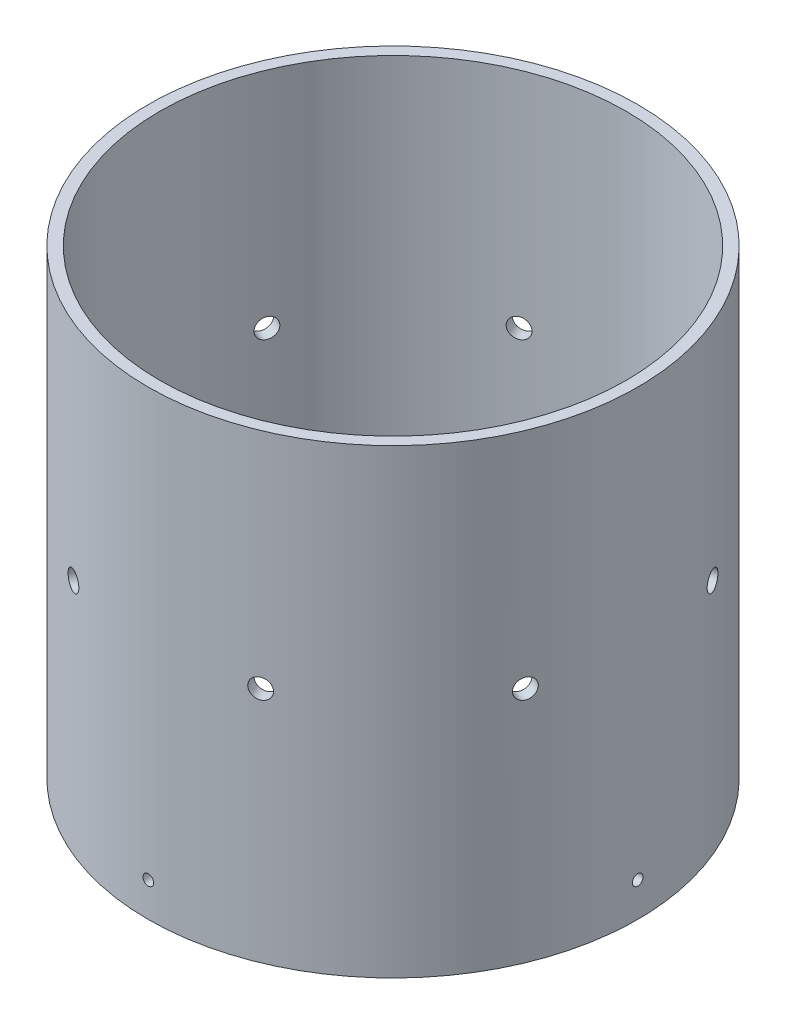
from build123d import *

# Parameters (mm, degrees)
BOSS_EXTRUDE1_START = 352.425
SKETCH1_R           = 55.626
SKETCH1_R_2         = 52.9844
BOSS_EXTRUDE1_DEPTH = 104.775
CIRPATTERN1_COUNT   = 4
CIRPATTERN2_COUNT   = 8


with BuildPart() as part:
    # Sketch1 → Boss-Extrude1 (new body)
    with BuildSketch(Plane(origin=(0, 0, 0), x_dir=(1, 0, 0), z_dir=(0, 1, 0)).offset(BOSS_EXTRUDE1_START)):
        with Locations(Location((0, 0, 0), (0, 0, 270))):
            Circle(SKETCH1_R)
        with Locations(Location((0, 0, 0), (0, 0, 270))):
            Circle(SKETCH1_R_2, mode=Mode.SUBTRACT)
    extrude(amount=BOSS_EXTRUDE1_DEPTH)

    # Sketch4 → #2 Clearance Hole1 (revolve, cut)
    with BuildSketch(Plane(origin=(0, 360.2228, 55.626), x_dir=(0, -1, 0), z_dir=(1, 0, 0))):
        Polygon((0, 0), (0, 55.596569267), (1.2192, 54.864), (1.2192, 0), align=None)
    f_2_clearance_hole1 = revolve(axis=Axis((0, 360.2228, 61.976), (0, 0, -1)), mode=Mode.SUBTRACT)

    # Sketch6 → #8 Clearance Hole1 (revolve, cut)
    with BuildSketch(Plane(origin=(21.287148609, 406.4, 51.391722875), x_dir=(0.9238795325112864, 0, -0.38268343236509056), z_dir=(0, 1, 0))):
        Polygon((0, 0), (0, 56.214674586), (2.2479, 54.864), (2.2479, 0), align=None)
    f_8_clearance_hole1 = revolve(axis=Axis((23.717188404, 406.4, 57.258357907), (-0.38268343236509056, 0, -0.9238795325112865)), mode=Mode.SUBTRACT)

    # CirPattern1: #2 Clearance Hole1 ×4 about axis
    cirpattern1_axis = Axis((0, 457.2, 0), (0, -1, 0))
    for i in range(1, CIRPATTERN1_COUNT):
        add(f_2_clearance_hole1.rotate(cirpattern1_axis, i * 360 / CIRPATTERN1_COUNT), mode=Mode.SUBTRACT)

    # CirPattern2: #8 Clearance Hole1 ×8 about axis
    cirpattern2_axis = Axis((0, 457.2, 0), (0, -1, 0))
    for i in range(1, CIRPATTERN2_COUNT):
        add(f_8_clearance_hole1.rotate(cirpattern2_axis, i * 360 / CIRPATTERN2_COUNT), mode=Mode.SUBTRACT)


solid = part.part
